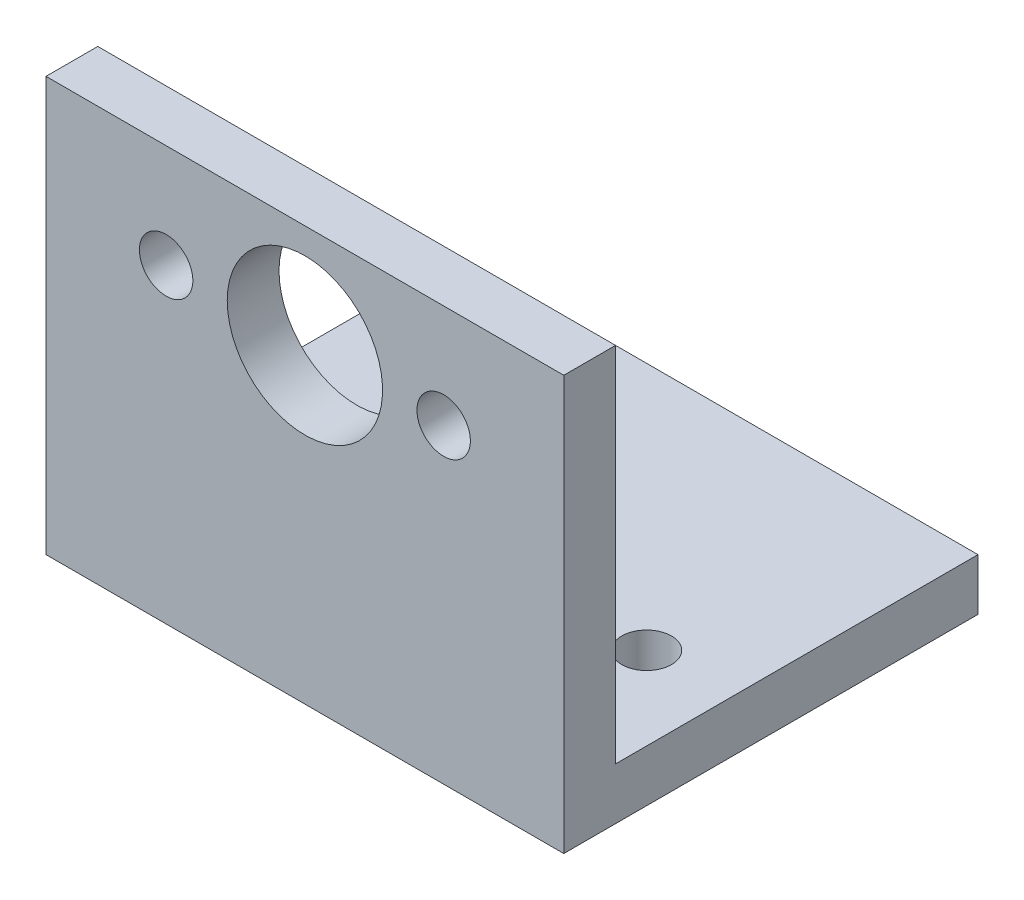
from build123d import *

# Parameters (mm, degrees)
BOSS_EXTRUDE1_DEPTH = 31.75
SKETCH3_R           = 4.7625
SKETCH3_R_2         = 1.6383
CUT_EXTRUDE1_DEPTH  = 47.337599474
SKETCH4_R           = 1.524
CUT_EXTRUDE2_DEPTH  = 47.337599474


with BuildPart() as part:
    # Sketch2 → Boss-Extrude1 (new body)
    with BuildSketch(Plane(origin=(0, 0, 0), x_dir=(0, 0, -1), z_dir=(1, 0, 0))):
        Polygon((0, 0), (25.4, 0), (25.4, 3.175), (3.175, 3.175), (3.175, 25.4), (0, 25.4), align=None)
    extrude(amount=BOSS_EXTRUDE1_DEPTH)

    # Sketch3 → Cut-Extrude1 (cut, through all)
    with BuildSketch(Plane(origin=(0, 0, -3.175), x_dir=(-1, 0, 0), z_dir=(0, 0, -1))):
        with Locations((-15.875, 19.05)):
            Circle(SKETCH3_R)
        with Locations((-7.366, 19.05)):
            Circle(SKETCH3_R_2)
        with Locations((-24.384, 19.05)):
            Circle(SKETCH3_R_2)
    extrude(amount=-CUT_EXTRUDE1_DEPTH, mode=Mode.SUBTRACT)

    # Sketch4 → Cut-Extrude2 (cut, through all)
    with BuildSketch(Plane(origin=(0, 3.175, 0), x_dir=(1, 0, 0), z_dir=(0, 1, 0))):
        with Locations(Location((5.08, 21.59, 0), (0, 0, 270))):
            Circle(SKETCH4_R)
        with Locations(Location((26.67, 10.16, 0), (0, 0, 270))):
            Circle(SKETCH4_R)
    extrude(amount=-CUT_EXTRUDE2_DEPTH, mode=Mode.SUBTRACT)


solid = part.part
